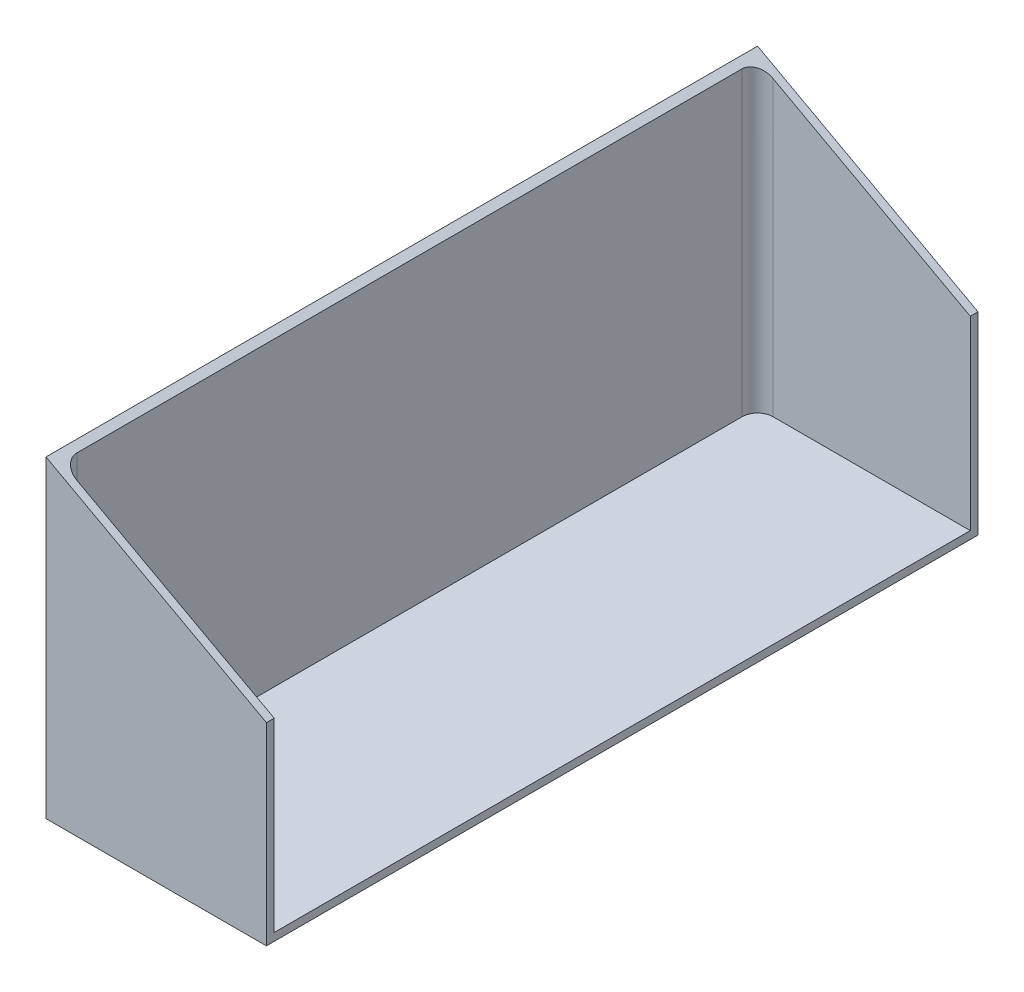
from build123d import *

# Parameters (mm, degrees)
BOSS_EXTRUDE1_DEPTH = 10
BOSS_EXTRUDE2_DEPTH = 910
FILLET1_R           = 20


with BuildPart() as part:
    # Sketch1 → Boss-Extrude1 (new body)
    with BuildSketch(Plane.XY):
        Polygon((0, 405), (285, 250), (285, 0), (0, 0), align=None)
    boss_extrude1 = extrude(amount=-BOSS_EXTRUDE1_DEPTH)

    # Sketch2 → Boss-Extrude2 (add)
    with BuildSketch(Plane.XY):
        Polygon((10, 0), (285, 0), (285, 10), (10, 10), (10, 399.561403509), (0, 405), (0, 10), (0, 0), align=None)
    extrude(amount=-BOSS_EXTRUDE2_DEPTH)

    # Mirror1: Boss-Extrude1 across plane
    add(boss_extrude1.mirror(Plane(origin=(0, 0, -460), x_dir=(1, 0, 0), z_dir=(0, 0, -1))))

    # Fillet1
    fillet1_edges = [part.edges().sort_by_distance(p)[0] for p in [
        (10, 204.780701754, -10),
        (10, 204.780701754, -910),
    ]]
    fillet(fillet1_edges, radius=FILLET1_R)


solid = part.part
